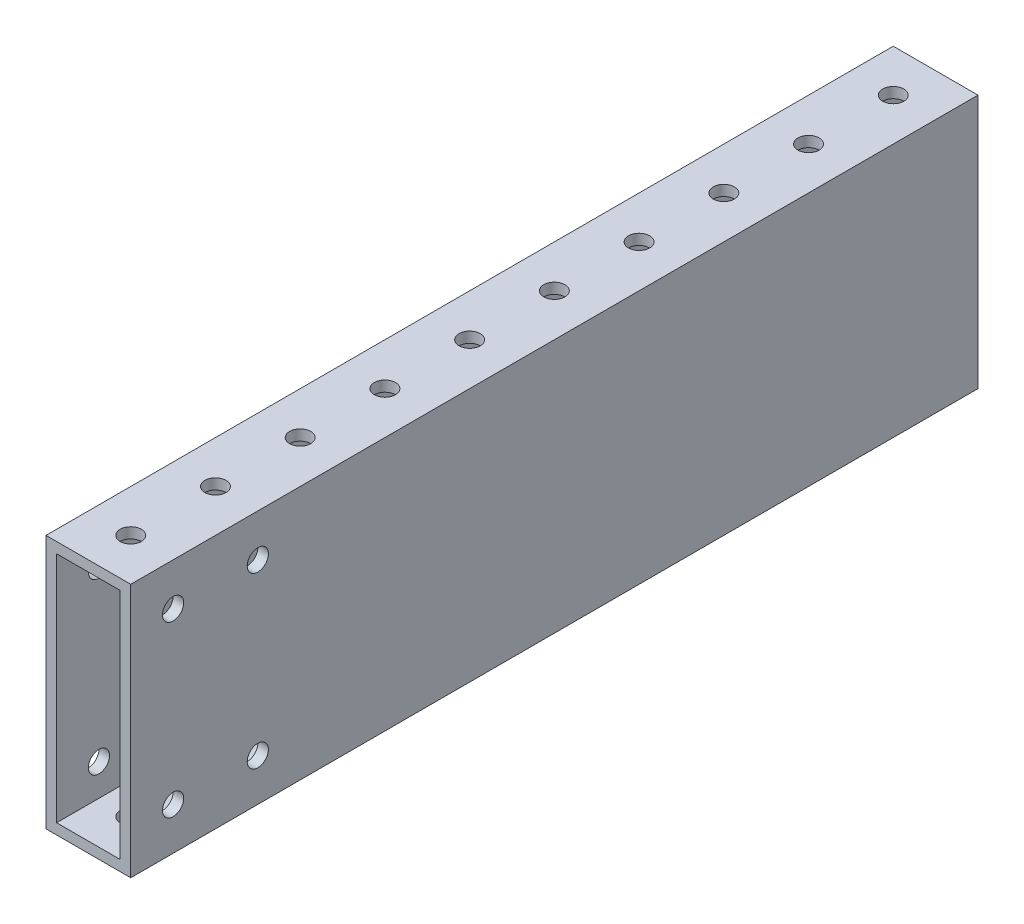
from build123d import *

# Parameters (mm, degrees)
SKETCH1_W               = 25.4
SKETCH1_H               = 76.2
SKETCH1_W_2             = 19.05
SKETCH1_H_2             = 69.85
BOSS_EXTRUDE3_DEPTH     = 254
SKETCH6_R               = 3.175
CUT_EXTRUDE1_DEPTH      = 806.45
CUT_EXTRUDE2_DEPTH      = 266.487720997
CUT_EXTRUDE2_DEPTH_BACK = 266.487720997
SKETCH7_R               = 3.175
CUT_EXTRUDE4_DEPTH      = 266.487720997
CUT_EXTRUDE4_DEPTH_BACK = 266.487720997
SKETCH8_R               = 3.175
CUT_EXTRUDE6_DEPTH      = 259.094498198
CUT_EXTRUDE6_DEPTH_BACK = 259.094498198
SKETCH11_R              = 3.175


with BuildPart() as part:
    # Sketch1 → Boss-Extrude3 (new body)
    with BuildSketch(Plane.XY):
        Rectangle(SKETCH1_W, SKETCH1_H)
        Rectangle(SKETCH1_W_2, SKETCH1_H_2, mode=Mode.SUBTRACT)
    extrude(amount=BOSS_EXTRUDE3_DEPTH)

    # Sketch6 → Cut-Extrude1 (cut)
    with BuildSketch(Plane(origin=(0, -38.1, 0), x_dir=(-1, 0, 0), z_dir=(0, -1, 0))):
        with Locations(Location((0, -12.7, 0), (0, 0, 180))):
            Circle(SKETCH6_R)
        with Locations(Location((0, -38.1, 0), (0, 0, 180))):
            Circle(SKETCH6_R)
        with Locations(Location((0, -241.3, 0), (0, 0, 180))):
            Circle(SKETCH6_R)
        with Locations(Location((0, -215.9, 0), (0, 0, 180))):
            Circle(SKETCH6_R)
    extrude(amount=-CUT_EXTRUDE1_DEPTH, mode=Mode.SUBTRACT)

    # Sketch7 → Cut-Extrude2 (cut, two sides: drawn at the far end of the back side and taken through both)
    with BuildSketch(Plane(origin=(0, -38.1, 0), x_dir=(-1, 0, 0), z_dir=(0, -1, 0)).offset(-CUT_EXTRUDE2_DEPTH_BACK)):
        with Locations(Location((0, -88.9, 0), (0, 0, 180))):
            Circle(SKETCH7_R)
        with Locations(Location((0, -114.3, 0), (0, 0, 180))):
            Circle(SKETCH7_R)
        with Locations(Location((0, -165.1, 0), (0, 0, 180))):
            Circle(SKETCH7_R)
        with Locations(Location((0, -139.7, 0), (0, 0, 180))):
            Circle(SKETCH7_R)
    extrude(amount=CUT_EXTRUDE2_DEPTH + CUT_EXTRUDE2_DEPTH_BACK, mode=Mode.SUBTRACT)

    # Sketch8 → Cut-Extrude4 (cut, two sides: drawn at the far end of the back side and taken through both)
    with BuildSketch(Plane(origin=(0, -38.1, 0), x_dir=(-1, 0, 0), z_dir=(0, -1, 0)).offset(-CUT_EXTRUDE4_DEPTH_BACK)):
        with Locations(Location((0, -190.5, 0), (0, 0, 180))):
            Circle(SKETCH8_R)
        with Locations(Location((0, -215.9, 0), (0, 0, 180))):
            Circle(SKETCH8_R)
        with Locations(Location((0, -63.5, 0), (0, 0, 180))):
            Circle(SKETCH8_R)
        with Locations(Location((0, -38.1, 0), (0, 0, 180))):
            Circle(SKETCH8_R)
    extrude(amount=CUT_EXTRUDE4_DEPTH + CUT_EXTRUDE4_DEPTH_BACK, mode=Mode.SUBTRACT)

    # Sketch11 → Cut-Extrude6 (cut, two sides: drawn at the far end of the back side and taken through both)
    with BuildSketch(Plane(origin=(12.7, 0, 0), x_dir=(0, 0, -1), z_dir=(1, 0, 0)).offset(-CUT_EXTRUDE6_DEPTH_BACK)):
        with Locations((-241.3, -25.4)):
            Circle(SKETCH11_R)
        with Locations((-215.9, -25.4)):
            Circle(SKETCH11_R)
        with Locations((-215.9, 25.4)):
            Circle(SKETCH11_R)
        with Locations((-241.3, 25.4)):
            Circle(SKETCH11_R)
    extrude(amount=CUT_EXTRUDE6_DEPTH + CUT_EXTRUDE6_DEPTH_BACK, mode=Mode.SUBTRACT)


solid = part.part
